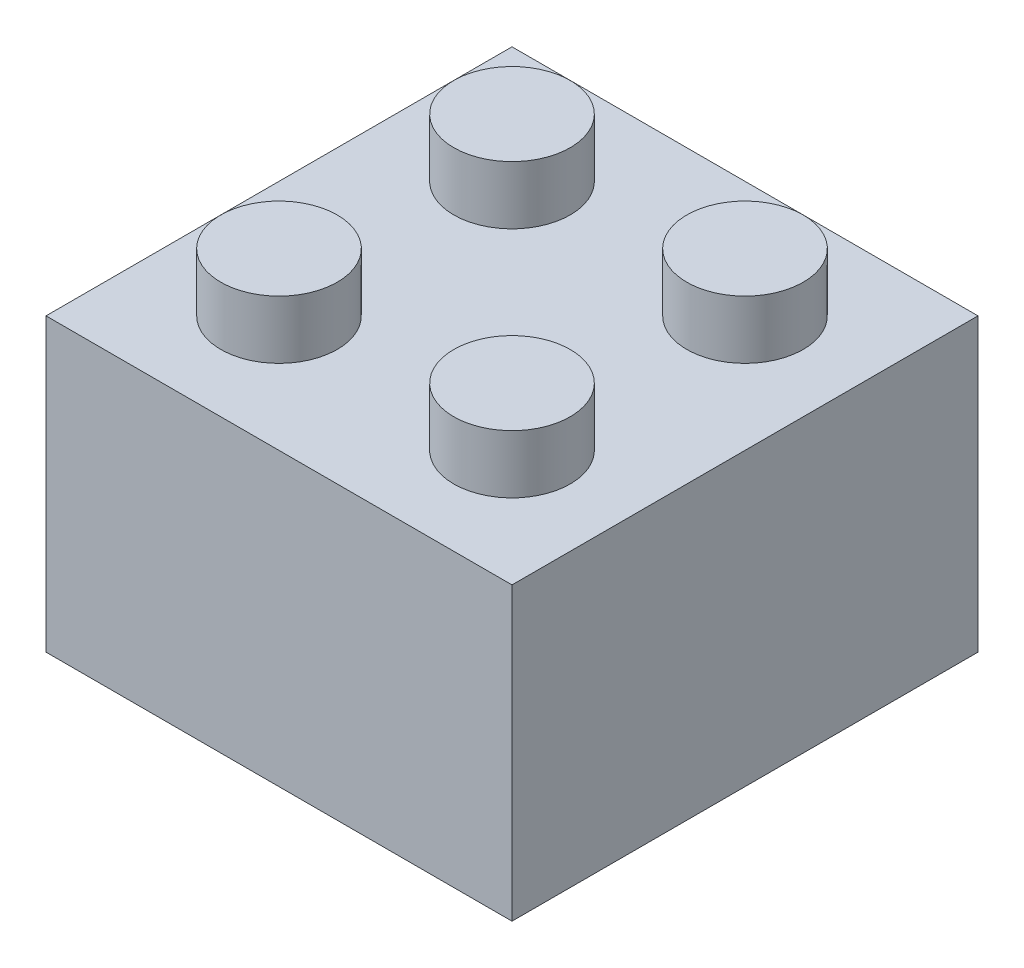
from build123d import *

# Parameters (mm, degrees)
SKETCH1_W           = 16
SKETCH1_H           = 16
BOSS_EXTRUDE1_DEPTH = 10
SKETCH2_R           = 2
BOSS_EXTRUDE2_DEPTH = 2
SHELL2_T            = -1
SKETCH3_R           = 2.7
SKETCH3_R_2         = 1.7
BOSS_EXTRUDE3_DEPTH = 9


with BuildPart() as part:
    # Sketch1 → Boss-Extrude1 (new body)
    with BuildSketch(Plane(origin=(0, 0, 0), x_dir=(1, 0, 0), z_dir=(0, 1, 0))):
        Rectangle(SKETCH1_W, SKETCH1_H)
    extrude(amount=BOSS_EXTRUDE1_DEPTH)

    # Sketch2 → Boss-Extrude2 (add)
    with BuildSketch(Plane(origin=(0, 10, 0), x_dir=(1, 0, 0), z_dir=(0, 1, 0))):
        with Locations(Location((-4, 4, 0), (0, 0, 270))):
            Circle(SKETCH2_R)
        with Locations(Location((4, 4, 0), (0, 0, 90))):
            Circle(SKETCH2_R)
        with Locations(Location((4, -4, 0), (0, 0, 270))):
            Circle(SKETCH2_R)
        with Locations(Location((-4, -4, 0), (0, 0, 90))):
            Circle(SKETCH2_R)
    extrude(amount=BOSS_EXTRUDE2_DEPTH)

    # Shell2
    shell2_openings = [part.faces().sort_by_distance(p)[0] for p in [
        (0, 0, 0),
    ]]
    offset(amount=SHELL2_T, openings=shell2_openings, kind=Kind.INTERSECTION)

    # Sketch3 → Boss-Extrude3 (add)
    with BuildSketch(Plane.XZ.offset(-9)):
        with Locations(Location((0, 0, 0), (0, 0, 90))):
            Circle(SKETCH3_R)
        with Locations(Location((0, 0, 0), (0, 0, 270))):
            Circle(SKETCH3_R_2, mode=Mode.SUBTRACT)
    extrude(amount=BOSS_EXTRUDE3_DEPTH)


solid = part.part
